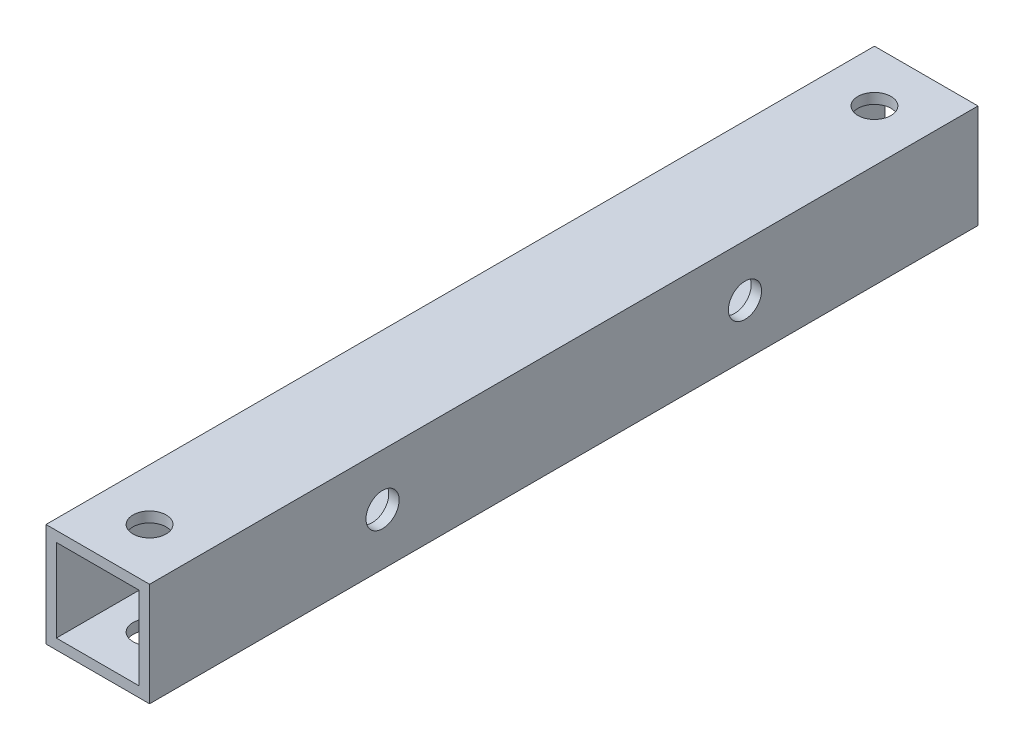
from build123d import *

# Parameters (mm, degrees)
SKETCH_281_W          = 10
SKETCH_281_H          = 10
SKETCH_281_W_2        = 8
SKETCH_281_H_2        = 8
EXTRUDE_338_DEPTH     = 80
SKETCH_410_R          = 1.6
CUT_EXTRUDE_755_DEPTH = 81.777472107
SKETCH_587_R          = 1.6
CUT_EXTRUDE_799_DEPTH = 81.777472107


with BuildPart() as part:
    # Sketch 281 → Extrude 338 (new body)
    with BuildSketch(Plane.XY):
        Rectangle(SKETCH_281_W, SKETCH_281_H)
        Rectangle(SKETCH_281_W_2, SKETCH_281_H_2, mode=Mode.SUBTRACT)
    extrude(amount=EXTRUDE_338_DEPTH)

    # Sketch 410 → Cut-Extrude 755 (cut, through all)
    with BuildSketch(Plane(origin=(0, 5, 0), x_dir=(1, 0, 0), z_dir=(0, 1, 0))):
        with Locations(Location((0, -5, 0), (0, 0, 270))):
            Circle(SKETCH_410_R)
        with Locations(Location((0, -75, 0), (0, 0, 270))):
            Circle(SKETCH_410_R)
    extrude(amount=-CUT_EXTRUDE_755_DEPTH, mode=Mode.SUBTRACT)

    # Sketch 587 → Cut-Extrude 799 (cut, through all)
    with BuildSketch(Plane(origin=(5, 0, 0), x_dir=(0, 0, -1), z_dir=(1, 0, 0))):
        with Locations((-22.5, 0)):
            Circle(SKETCH_587_R)
        with Locations((-57.5, 0)):
            Circle(SKETCH_587_R)
    extrude(amount=-CUT_EXTRUDE_799_DEPTH, mode=Mode.SUBTRACT)


solid = part.part
